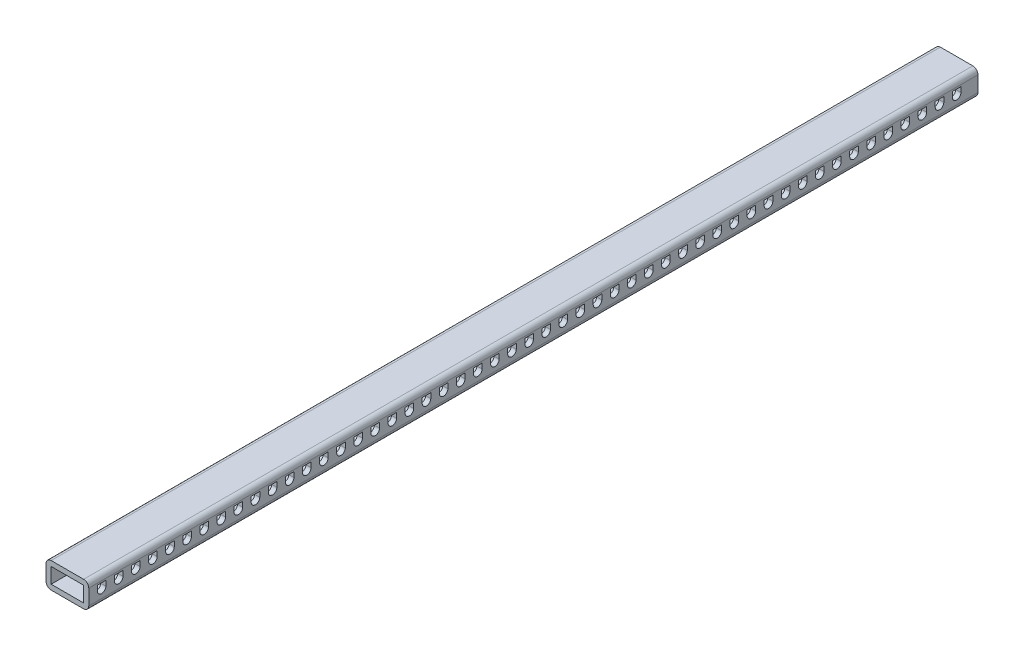
from build123d import *

# Parameters (mm, degrees)
SKETCH1_W           = 25
SKETCH1_H           = 15
BOSS_EXTRUDE1_DEPTH = 520
SKETCH2_W           = 19
SKETCH2_H           = 9
CUT_EXTRUDE1_DEPTH  = 263
CUT_EXTRUDE2_DEPTH  = 263
FILLET1_R           = 3
CUT_EXTRUDE6_DEPTH  = 29
SKETCH8_W           = 19
SKETCH8_H           = 9
CUT_EXTRUDE7_DEPTH  = 535


with BuildPart() as part:
    # Sketch1 → Boss-Extrude1 (new body)
    with BuildSketch(Plane.XY):
        Rectangle(SKETCH1_W, SKETCH1_H)
    extrude(amount=BOSS_EXTRUDE1_DEPTH)

    # Sketch2 → Cut-Extrude1 (cut)
    with BuildSketch(Plane.XY.offset(520)):
        Rectangle(SKETCH2_W, SKETCH2_H)
    extrude(amount=-CUT_EXTRUDE1_DEPTH, mode=Mode.SUBTRACT)

    # Sketch3 → Cut-Extrude2 (cut)
    with BuildSketch(Plane(origin=(12.5, 0, 0), x_dir=(0, 0, -1), z_dir=(1, 0, 0))):
        with BuildLine():
            Line((-515, 3.5), (-515, 0.5))
            ThreePointArc((-515, 0.5), (-512.5, -2), (-510, 0.5))
            Line((-510, 0.5), (-510, 3.5))
            Line((-510, 3.5), (-515, 3.5))
        make_face()
        with BuildLine():
            ThreePointArc((-500, 0.5), (-502.5, -2), (-505, 0.5))
            Line((-505, 0.5), (-505, 3.5))
            Line((-505, 3.5), (-500, 3.5))
            Line((-500, 3.5), (-500, 0.5))
        make_face()
        with BuildLine():
            Line((-495, 3.5), (-495, 0.5))
            ThreePointArc((-495, 0.5), (-492.5, -2), (-490, 0.5))
            Line((-490, 0.5), (-490, 3.5))
            Line((-490, 3.5), (-495, 3.5))
        make_face()
        with BuildLine():
            ThreePointArc((-480, 0.5), (-482.5, -2), (-485, 0.5))
            Line((-485, 0.5), (-485, 3.5))
            Line((-485, 3.5), (-480, 3.5))
            Line((-480, 3.5), (-480, 0.5))
        make_face()
        with BuildLine():
            Line((-475, 3.5), (-475, 0.5))
            ThreePointArc((-475, 0.5), (-472.5, -2), (-470, 0.5))
            Line((-470, 0.5), (-470, 3.5))
            Line((-470, 3.5), (-475, 3.5))
        make_face()
        with BuildLine():
            ThreePointArc((-460, 0.5), (-462.5, -2), (-465, 0.5))
            Line((-465, 0.5), (-465, 3.5))
            Line((-465, 3.5), (-460, 3.5))
            Line((-460, 3.5), (-460, 0.5))
        make_face()
        with BuildLine():
            Line((-455, 3.5), (-455, 0.5))
            ThreePointArc((-455, 0.5), (-452.5, -2), (-450, 0.5))
            Line((-450, 0.5), (-450, 3.5))
            Line((-450, 3.5), (-455, 3.5))
        make_face()
        with BuildLine():
            ThreePointArc((-440, 0.5), (-442.5, -2), (-445, 0.5))
            Line((-445, 0.5), (-445, 3.5))
            Line((-445, 3.5), (-440, 3.5))
            Line((-440, 3.5), (-440, 0.5))
        make_face()
        with BuildLine():
            Line((-435, 3.5), (-435, 0.5))
            ThreePointArc((-435, 0.5), (-432.5, -2), (-430, 0.5))
            Line((-430, 0.5), (-430, 3.5))
            Line((-430, 3.5), (-435, 3.5))
        make_face()
        with BuildLine():
            ThreePointArc((-420, 0.5), (-422.5, -2), (-425, 0.5))
            Line((-425, 0.5), (-425, 3.5))
            Line((-425, 3.5), (-420, 3.5))
            Line((-420, 3.5), (-420, 0.5))
        make_face()
        with BuildLine():
            Line((-415, 3.5), (-415, 0.5))
            ThreePointArc((-415, 0.5), (-412.5, -2), (-410, 0.5))
            Line((-410, 0.5), (-410, 3.5))
            Line((-410, 3.5), (-415, 3.5))
        make_face()
        with BuildLine():
            ThreePointArc((-400, 0.5), (-402.5, -2), (-405, 0.5))
            Line((-405, 0.5), (-405, 3.5))
            Line((-405, 3.5), (-400, 3.5))
            Line((-400, 3.5), (-400, 0.5))
        make_face()
        with BuildLine():
            Line((-395, 3.5), (-395, 0.5))
            ThreePointArc((-395, 0.5), (-392.5, -2), (-390, 0.5))
            Line((-390, 0.5), (-390, 3.5))
            Line((-390, 3.5), (-395, 3.5))
        make_face()
        with BuildLine():
            ThreePointArc((-380, 0.5), (-382.5, -2), (-385, 0.5))
            Line((-385, 0.5), (-385, 3.5))
            Line((-385, 3.5), (-380, 3.5))
            Line((-380, 3.5), (-380, 0.5))
        make_face()
        with BuildLine():
            Line((-375, 3.5), (-375, 0.5))
            ThreePointArc((-375, 0.5), (-372.5, -2), (-370, 0.5))
            Line((-370, 0.5), (-370, 3.5))
            Line((-370, 3.5), (-375, 3.5))
        make_face()
        with BuildLine():
            ThreePointArc((-360, 0.5), (-362.5, -2), (-365, 0.5))
            Line((-365, 0.5), (-365, 3.5))
            Line((-365, 3.5), (-360, 3.5))
            Line((-360, 3.5), (-360, 0.5))
        make_face()
        with BuildLine():
            Line((-355, 3.5), (-355, 0.5))
            ThreePointArc((-355, 0.5), (-352.5, -2), (-350, 0.5))
            Line((-350, 0.5), (-350, 3.5))
            Line((-350, 3.5), (-355, 3.5))
        make_face()
        with BuildLine():
            ThreePointArc((-340, 0.5), (-342.5, -2), (-345, 0.5))
            Line((-345, 0.5), (-345, 3.5))
            Line((-345, 3.5), (-340, 3.5))
            Line((-340, 3.5), (-340, 0.5))
        make_face()
        with BuildLine():
            Line((-335, 3.5), (-335, 0.5))
            ThreePointArc((-335, 0.5), (-332.5, -2), (-330, 0.5))
            Line((-330, 0.5), (-330, 3.5))
            Line((-330, 3.5), (-335, 3.5))
        make_face()
        with BuildLine():
            ThreePointArc((-320, 0.5), (-322.5, -2), (-325, 0.5))
            Line((-325, 0.5), (-325, 3.5))
            Line((-325, 3.5), (-320, 3.5))
            Line((-320, 3.5), (-320, 0.5))
        make_face()
        with BuildLine():
            Line((-315, 3.5), (-315, 0.5))
            ThreePointArc((-315, 0.5), (-312.5, -2), (-310, 0.5))
            Line((-310, 0.5), (-310, 3.5))
            Line((-310, 3.5), (-315, 3.5))
        make_face()
        with BuildLine():
            ThreePointArc((-300, 0.5), (-302.5, -2), (-305, 0.5))
            Line((-305, 0.5), (-305, 3.5))
            Line((-305, 3.5), (-300, 3.5))
            Line((-300, 3.5), (-300, 0.5))
        make_face()
    extrude(amount=-CUT_EXTRUDE2_DEPTH, mode=Mode.SUBTRACT)

    # Fillet1
    fillet1_edges = [part.edges().sort_by_distance(p)[0] for p in [
        (12.5, -7.5, 260),
        (-12.5, -7.5, 260),
        (-12.5, 7.5, 260),
        (12.5, 7.5, 260),
    ]]
    fillet(fillet1_edges, radius=FILLET1_R)

    # Sketch7 → Cut-Extrude6 (cut)
    with BuildSketch(Plane(origin=(12.5, 0, 0), x_dir=(0, 0, -1), z_dir=(1, 0, 0))):
        with BuildLine():
            ThreePointArc((-290, 0.5), (-292.5, -2), (-295, 0.5))
            Line((-295, 0.5), (-295, 3.5))
            Line((-295, 3.5), (-290, 3.5))
            Line((-290, 3.5), (-290, 0.5))
        make_face()
        with BuildLine():
            Line((-285, 0.5), (-285, 3.5))
            Line((-285, 3.5), (-280, 3.5))
            Line((-280, 3.5), (-280, 0.5))
            ThreePointArc((-280, 0.5), (-282.5, -2), (-285, 0.5))
        make_face()
        with BuildLine():
            ThreePointArc((-270, 0.5), (-272.5, -2), (-275, 0.5))
            Line((-275, 0.5), (-275, 3.5))
            Line((-275, 3.5), (-270, 3.5))
            Line((-270, 3.5), (-270, 0.5))
        make_face()
        with BuildLine():
            Line((-265, 0.5), (-265, 3.5))
            Line((-265, 3.5), (-260, 3.5))
            Line((-260, 3.5), (-260, 0.5))
            ThreePointArc((-260, 0.5), (-262.5, -2), (-265, 0.5))
        make_face()
        with BuildLine():
            ThreePointArc((-250, 0.5), (-252.5, -2), (-255, 0.5))
            Line((-255, 0.5), (-255, 3.5))
            Line((-255, 3.5), (-250, 3.5))
            Line((-250, 3.5), (-250, 0.5))
        make_face()
        with BuildLine():
            Line((-245, 0.5), (-245, 3.5))
            Line((-245, 3.5), (-240, 3.5))
            Line((-240, 3.5), (-240, 0.5))
            ThreePointArc((-240, 0.5), (-242.5, -2), (-245, 0.5))
        make_face()
        with BuildLine():
            ThreePointArc((-230, 0.5), (-232.5, -2), (-235, 0.5))
            Line((-235, 0.5), (-235, 3.5))
            Line((-235, 3.5), (-230, 3.5))
            Line((-230, 3.5), (-230, 0.5))
        make_face()
        with BuildLine():
            Line((-225, 0.5), (-225, 3.5))
            Line((-225, 3.5), (-220, 3.5))
            Line((-220, 3.5), (-220, 0.5))
            ThreePointArc((-220, 0.5), (-222.5, -2), (-225, 0.5))
        make_face()
        with BuildLine():
            ThreePointArc((-210, 0.5), (-212.5, -2), (-215, 0.5))
            Line((-215, 0.5), (-215, 3.5))
            Line((-215, 3.5), (-210, 3.5))
            Line((-210, 3.5), (-210, 0.5))
        make_face()
        with BuildLine():
            Line((-205, 0.5), (-205, 3.5))
            Line((-205, 3.5), (-200, 3.5))
            Line((-200, 3.5), (-200, 0.5))
            ThreePointArc((-200, 0.5), (-202.5, -2), (-205, 0.5))
        make_face()
        with BuildLine():
            ThreePointArc((-190, 0.5), (-192.5, -2), (-195, 0.5))
            Line((-195, 0.5), (-195, 3.5))
            Line((-195, 3.5), (-190, 3.5))
            Line((-190, 3.5), (-190, 0.5))
        make_face()
        with BuildLine():
            Line((-185, 0.5), (-185, 3.5))
            Line((-185, 3.5), (-180, 3.5))
            Line((-180, 3.5), (-180, 0.5))
            ThreePointArc((-180, 0.5), (-182.5, -2), (-185, 0.5))
        make_face()
        with BuildLine():
            ThreePointArc((-170, 0.5), (-172.5, -2), (-175, 0.5))
            Line((-175, 0.5), (-175, 3.5))
            Line((-175, 3.5), (-170, 3.5))
            Line((-170, 3.5), (-170, 0.5))
        make_face()
        with BuildLine():
            Line((-165, 0.5), (-165, 3.5))
            Line((-165, 3.5), (-160, 3.5))
            Line((-160, 3.5), (-160, 0.5))
            ThreePointArc((-160, 0.5), (-162.5, -2), (-165, 0.5))
        make_face()
        with BuildLine():
            ThreePointArc((-150, 0.5), (-152.5, -2), (-155, 0.5))
            Line((-155, 0.5), (-155, 3.5))
            Line((-155, 3.5), (-150, 3.5))
            Line((-150, 3.5), (-150, 0.5))
        make_face()
        with BuildLine():
            Line((-145, 0.5), (-145, 3.5))
            Line((-145, 3.5), (-140, 3.5))
            Line((-140, 3.5), (-140, 0.5))
            ThreePointArc((-140, 0.5), (-142.5, -2), (-145, 0.5))
        make_face()
        with BuildLine():
            ThreePointArc((-130, 0.5), (-132.5, -2), (-135, 0.5))
            Line((-135, 0.5), (-135, 3.5))
            Line((-135, 3.5), (-130, 3.5))
            Line((-130, 3.5), (-130, 0.5))
        make_face()
        with BuildLine():
            Line((-125, 0.5), (-125, 3.5))
            Line((-125, 3.5), (-120, 3.5))
            Line((-120, 3.5), (-120, 0.5))
            ThreePointArc((-120, 0.5), (-122.5, -2), (-125, 0.5))
        make_face()
        with BuildLine():
            ThreePointArc((-110, 0.5), (-112.5, -2), (-115, 0.5))
            Line((-115, 0.5), (-115, 3.5))
            Line((-115, 3.5), (-110, 3.5))
            Line((-110, 3.5), (-110, 0.5))
        make_face()
        with BuildLine():
            Line((-105, 0.5), (-105, 3.5))
            Line((-105, 3.5), (-100, 3.5))
            Line((-100, 3.5), (-100, 0.5))
            ThreePointArc((-100, 0.5), (-102.5, -2), (-105, 0.5))
        make_face()
        with BuildLine():
            ThreePointArc((-90, 0.5), (-92.5, -2), (-95, 0.5))
            Line((-95, 0.5), (-95, 3.5))
            Line((-95, 3.5), (-90, 3.5))
            Line((-90, 3.5), (-90, 0.5))
        make_face()
        with BuildLine():
            Line((-85, 0.5), (-85, 3.5))
            Line((-85, 3.5), (-80, 3.5))
            Line((-80, 3.5), (-80, 0.5))
            ThreePointArc((-80, 0.5), (-82.5, -2), (-85, 0.5))
        make_face()
        with BuildLine():
            ThreePointArc((-70, 0.5), (-72.5, -2), (-75, 0.5))
            Line((-75, 0.5), (-75, 3.5))
            Line((-75, 3.5), (-70, 3.5))
            Line((-70, 3.5), (-70, 0.5))
        make_face()
        with BuildLine():
            Line((-65, 0.5), (-65, 3.5))
            Line((-65, 3.5), (-60, 3.5))
            Line((-60, 3.5), (-60, 0.5))
            ThreePointArc((-60, 0.5), (-62.5, -2), (-65, 0.5))
        make_face()
        with BuildLine():
            ThreePointArc((-50, 0.5), (-52.5, -2), (-55, 0.5))
            Line((-55, 0.5), (-55, 3.5))
            Line((-55, 3.5), (-50, 3.5))
            Line((-50, 3.5), (-50, 0.5))
        make_face()
        with BuildLine():
            Line((-45, 0.5), (-45, 3.5))
            Line((-45, 3.5), (-40, 3.5))
            Line((-40, 3.5), (-40, 0.5))
            ThreePointArc((-40, 0.5), (-42.5, -2), (-45, 0.5))
        make_face()
        with BuildLine():
            ThreePointArc((-30, 0.5), (-32.5, -2), (-35, 0.5))
            Line((-35, 0.5), (-35, 3.5))
            Line((-35, 3.5), (-30, 3.5))
            Line((-30, 3.5), (-30, 0.5))
        make_face()
        with BuildLine():
            Line((-25, 0.5), (-25, 3.5))
            Line((-25, 3.5), (-20, 3.5))
            Line((-20, 3.5), (-20, 0.5))
            ThreePointArc((-20, 0.5), (-22.5, -2), (-25, 0.5))
        make_face()
        with BuildLine():
            ThreePointArc((-10, 0.5), (-12.5, -2), (-15, 0.5))
            Line((-15, 0.5), (-15, 3.5))
            Line((-15, 3.5), (-10, 3.5))
            Line((-10, 3.5), (-10, 0.5))
        make_face()
    extrude(amount=-CUT_EXTRUDE6_DEPTH, mode=Mode.SUBTRACT)

    # Sketch8 → Cut-Extrude7 (cut)
    with BuildSketch(Plane(origin=(0, 0, 0), x_dir=(-1, 0, 0), z_dir=(0, 0, -1))):
        Rectangle(SKETCH8_W, SKETCH8_H)
    extrude(amount=-CUT_EXTRUDE7_DEPTH, mode=Mode.SUBTRACT)


solid = part.part
